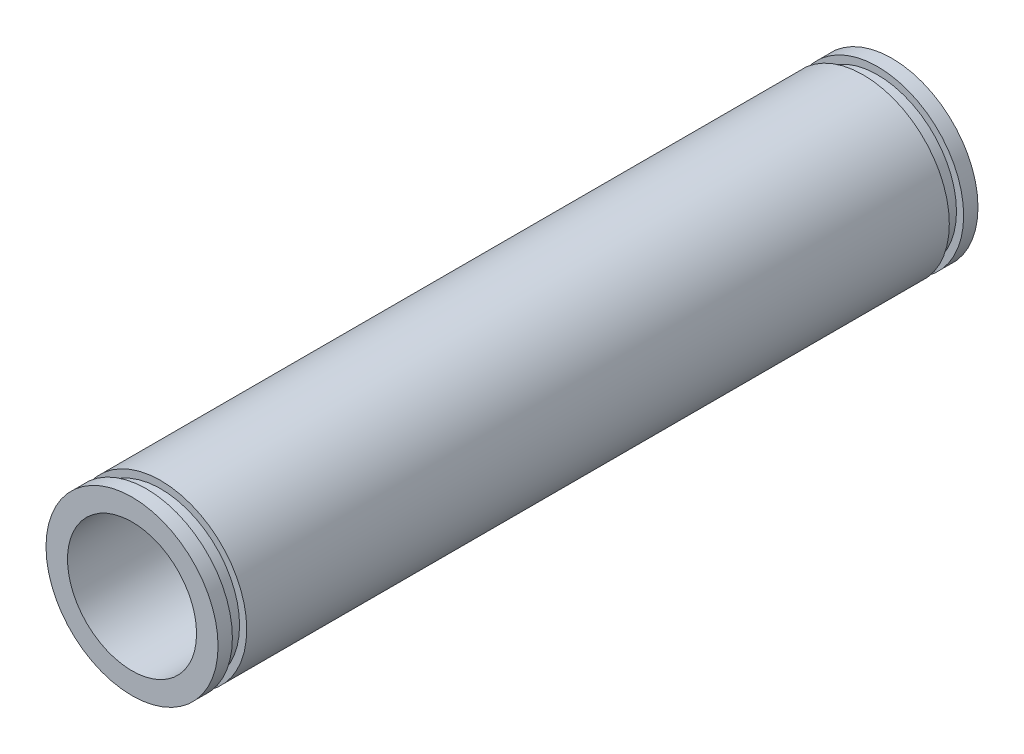
from build123d import *

# Parameters (mm, degrees)
SKETCH_1_R          = 6
SKETCH_1_R_2        = 4.5
EXTRUDE_1_DEPTH     = 26.5
CUT_EXTRUDE_START   = -1
SKETCH_2_R          = 6
SKETCH_2_R_2        = 5.5
CUT_EXTRUDE_1_DEPTH = 1


with BuildPart() as part:
    # Эскиз1 → Бобышка-Вытянуть1 (new, symmetric)
    with BuildSketch(Plane.XY):
        Circle(SKETCH_1_R)
        Circle(SKETCH_1_R_2, mode=Mode.SUBTRACT)
    extrude(amount=EXTRUDE_1_DEPTH, both=True)

    # Эскиз2 → Вырез-Вытянуть1 (cut)
    with BuildSketch(Plane.XY.offset(26.5).offset(CUT_EXTRUDE_START)):
        Circle(SKETCH_2_R)
        Circle(SKETCH_2_R_2, mode=Mode.SUBTRACT)
    cut_extrude_1 = extrude(amount=-CUT_EXTRUDE_1_DEPTH, mode=Mode.SUBTRACT)

    # Зеркальное отражение1: Вырез-Вытянуть1 across plane
    add(cut_extrude_1.mirror(Plane.XY), mode=Mode.SUBTRACT)


solid = part.part
